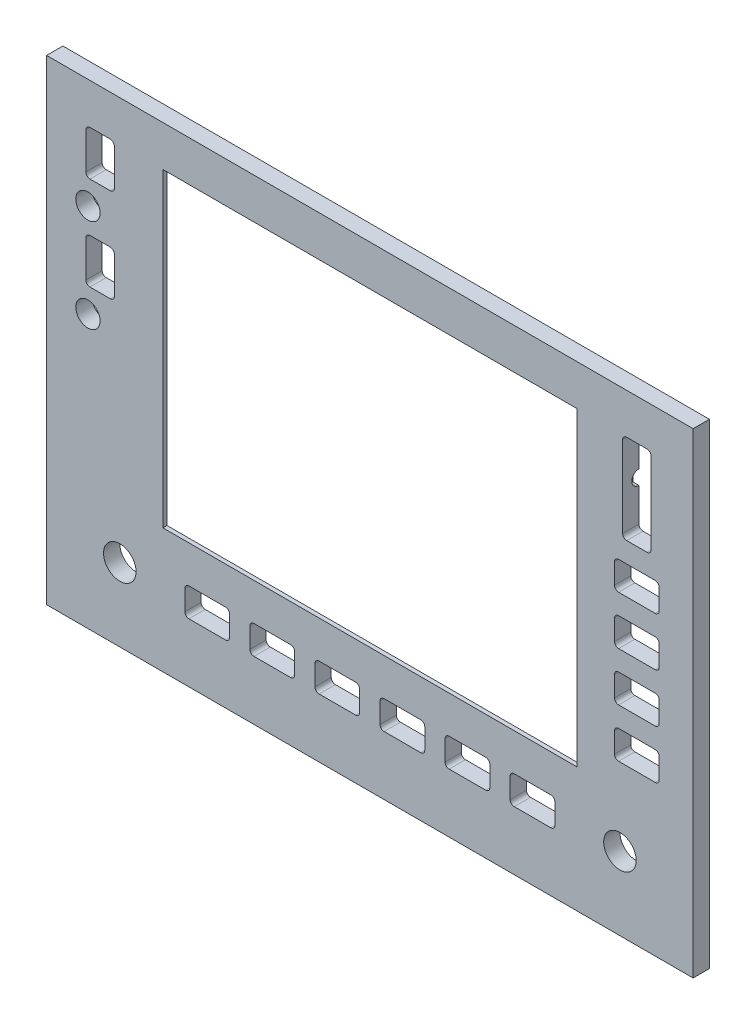
from build123d import *

# Parameters (mm, degrees)
ESQUISSE1_W                  = 159
ESQUISSE1_H                  = 117
BOSS_EXTRU_1_DEPTH           = 4
ESQUISSE3_W                  = 101.76
ESQUISSE3_H                  = 76.32
ENL_V_MAT_EXTRU_2_DEPTH      = 4
ESQUISSE9_W                  = 118
ESQUISSE9_H                  = 88.9
ENL_V_MAT_EXTRU_5_DEPTH      = 3
ESQUISSE4_R                  = 4
ENL_V_MAT_EXTRU_3_DEPTH      = 4
ESQUISSE10_R                 = 3
ENL_V_MAT_EXTRU_6_DEPTH      = 4
ENL_V_MAT_EXTRU_7_DEPTH      = 8.5
ENL_V_MAT_EXTRU_7_DEPTH_BACK = 1.5
ESQUISSE11_R                 = 1.75


with BuildPart() as part:
    # Esquisse1 → Boss.-Extru.1 (new body)
    with BuildSketch(Plane.XY):
        with Locations((79.5, 58.5)):
            Rectangle(ESQUISSE1_W, ESQUISSE1_H)
    extrude(amount=BOSS_EXTRU_1_DEPTH)

    # Esquisse3 → Enlèv. mat.-Extru.2 (cut)
    with BuildSketch(Plane.XY.offset(4)):
        with Locations((79.5, 68.84)):
            Rectangle(ESQUISSE3_W, ESQUISSE3_H)
    extrude(amount=-ENL_V_MAT_EXTRU_2_DEPTH, mode=Mode.SUBTRACT)

    # Esquisse9 → Enlèv. mat.-Extru.5 (cut)
    with BuildSketch(Plane(origin=(0, 0, 0), x_dir=(-1, 0, 0), z_dir=(0, 0, -1))):
        with Locations((-79.163992303, 67.176625881)):
            Rectangle(ESQUISSE9_W, ESQUISSE9_H)
    extrude(amount=-ENL_V_MAT_EXTRU_5_DEPTH, mode=Mode.SUBTRACT)

    # Esquisse4 → Enlèv. mat.-Extru.3 (cut)
    with BuildSketch(Plane.XY.offset(4)):
        with Locations((141, 18)):
            Circle(ESQUISSE4_R)
        with Locations((18, 18)):
            Circle(ESQUISSE4_R)
    extrude(amount=-ENL_V_MAT_EXTRU_3_DEPTH, mode=Mode.SUBTRACT)

    # Esquisse10 → Enlèv. mat.-Extru.6 (cut)
    with BuildSketch(Plane(origin=(0, 0, 0), x_dir=(-1, 0, 0), z_dir=(0, 0, -1))):
        with Locations((-10.163992303, 90)):
            Circle(ESQUISSE10_R)
        with Locations((-10.163992303, 67)):
            Circle(ESQUISSE10_R)
        with BuildLine():
            Line((-124, 21.5), (-115, 21.5))
            ThreePointArc((-115, 21.5), (-114.292893219, 21.207106781), (-114, 20.5))
            Line((-114, 20.5), (-114, 15.5))
            ThreePointArc((-114, 15.5), (-114.292893219, 14.792893219), (-115, 14.5))
            Line((-115, 14.5), (-124, 14.5))
            ThreePointArc((-124, 14.5), (-124.707106781, 14.792893219), (-125, 15.5))
            Line((-125, 15.5), (-125, 20.5))
            ThreePointArc((-125, 20.5), (-124.707106781, 21.207106781), (-124, 21.5))
        make_face()
        with BuildLine():
            Line((-108, 21.5), (-99, 21.5))
            ThreePointArc((-99, 21.5), (-98.292893219, 21.207106781), (-98, 20.5))
            Line((-98, 20.5), (-98, 15.5))
            ThreePointArc((-98, 15.5), (-98.292893219, 14.792893219), (-99, 14.5))
            Line((-99, 14.5), (-108, 14.5))
            ThreePointArc((-108, 14.5), (-108.707106781, 14.792893219), (-109, 15.5))
            Line((-109, 15.5), (-109, 20.5))
            ThreePointArc((-109, 20.5), (-108.707106781, 21.207106781), (-108, 21.5))
        make_face()
        with BuildLine():
            Line((-92, 21.5), (-83, 21.5))
            ThreePointArc((-83, 21.5), (-82.292893219, 21.207106781), (-82, 20.5))
            Line((-82, 20.5), (-82, 15.5))
            ThreePointArc((-82, 15.5), (-82.292893219, 14.792893219), (-83, 14.5))
            Line((-83, 14.5), (-92, 14.5))
            ThreePointArc((-92, 14.5), (-92.707106781, 14.792893219), (-93, 15.5))
            Line((-93, 15.5), (-93, 20.5))
            ThreePointArc((-93, 20.5), (-92.707106781, 21.207106781), (-92, 21.5))
        make_face()
        with BuildLine():
            Line((-76, 21.5), (-67, 21.5))
            ThreePointArc((-67, 21.5), (-66.292893219, 21.207106781), (-66, 20.5))
            Line((-66, 20.5), (-66, 15.5))
            ThreePointArc((-66, 15.5), (-66.292893219, 14.792893219), (-67, 14.5))
            Line((-67, 14.5), (-76, 14.5))
            ThreePointArc((-76, 14.5), (-76.707106781, 14.792893219), (-77, 15.5))
            Line((-77, 15.5), (-77, 20.5))
            ThreePointArc((-77, 20.5), (-76.707106781, 21.207106781), (-76, 21.5))
        make_face()
        with BuildLine():
            Line((-60, 21.5), (-51, 21.5))
            ThreePointArc((-51, 21.5), (-50.292893219, 21.207106781), (-50, 20.5))
            Line((-50, 20.5), (-50, 15.5))
            ThreePointArc((-50, 15.5), (-50.292893219, 14.792893219), (-51, 14.5))
            Line((-51, 14.5), (-60, 14.5))
            ThreePointArc((-60, 14.5), (-60.707106781, 14.792893219), (-61, 15.5))
            Line((-61, 15.5), (-61, 20.5))
            ThreePointArc((-61, 20.5), (-60.707106781, 21.207106781), (-60, 21.5))
        make_face()
        with BuildLine():
            Line((-44, 21.5), (-35, 21.5))
            ThreePointArc((-35, 21.5), (-34.292893219, 21.207106781), (-34, 20.5))
            Line((-34, 20.5), (-34, 15.5))
            ThreePointArc((-34, 15.5), (-34.292893219, 14.792893219), (-35, 14.5))
            Line((-35, 14.5), (-44, 14.5))
            ThreePointArc((-44, 14.5), (-44.707106781, 14.792893219), (-45, 15.5))
            Line((-45, 15.5), (-45, 20.5))
            ThreePointArc((-45, 20.5), (-44.707106781, 21.207106781), (-44, 21.5))
        make_face()
        with BuildLine():
            Line((-147.663992303, 107), (-142.663992303, 107))
            ThreePointArc((-142.663992303, 107), (-141.956885522, 106.707106781), (-141.663992303, 106))
            Line((-141.663992303, 106), (-141.663992303, 86))
            ThreePointArc((-141.663992303, 86), (-141.956885522, 85.292893219), (-142.663992303, 85))
            Line((-142.663992303, 85), (-147.663992303, 85))
            ThreePointArc((-147.663992303, 85), (-148.371099084, 85.292893219), (-148.663992303, 86))
            Line((-148.663992303, 86), (-148.663992303, 106))
            ThreePointArc((-148.663992303, 106), (-148.371099084, 106.707106781), (-147.663992303, 107))
        make_face()
        with BuildLine():
            Line((-149.663992303, 80), (-140.663992303, 80))
            ThreePointArc((-140.663992303, 80), (-139.956885522, 79.707106781), (-139.663992303, 79))
            Line((-139.663992303, 79), (-139.663992303, 74))
            ThreePointArc((-139.663992303, 74), (-139.956885522, 73.292893219), (-140.663992303, 73))
            Line((-140.663992303, 73), (-149.663992303, 73))
            ThreePointArc((-149.663992303, 73), (-150.371099084, 73.292893219), (-150.663992303, 74))
            Line((-150.663992303, 74), (-150.663992303, 79))
            ThreePointArc((-150.663992303, 79), (-150.371099084, 79.707106781), (-149.663992303, 80))
        make_face()
        with BuildLine():
            Line((-149.663992303, 68), (-140.663992303, 68))
            ThreePointArc((-140.663992303, 68), (-139.956885522, 67.707106781), (-139.663992303, 67))
            Line((-139.663992303, 67), (-139.663992303, 62))
            ThreePointArc((-139.663992303, 62), (-139.956885522, 61.292893219), (-140.663992303, 61))
            Line((-140.663992303, 61), (-149.663992303, 61))
            ThreePointArc((-149.663992303, 61), (-150.371099084, 61.292893219), (-150.663992303, 62))
            Line((-150.663992303, 62), (-150.663992303, 67))
            ThreePointArc((-150.663992303, 67), (-150.371099084, 67.707106781), (-149.663992303, 68))
        make_face()
        with BuildLine():
            Line((-149.663992303, 56), (-140.663992303, 56))
            ThreePointArc((-140.663992303, 56), (-139.956885522, 55.707106781), (-139.663992303, 55))
            Line((-139.663992303, 55), (-139.663992303, 50))
            ThreePointArc((-139.663992303, 50), (-139.956885522, 49.292893219), (-140.663992303, 49))
            Line((-140.663992303, 49), (-149.663992303, 49))
            ThreePointArc((-149.663992303, 49), (-150.371099084, 49.292893219), (-150.663992303, 50))
            Line((-150.663992303, 50), (-150.663992303, 55))
            ThreePointArc((-150.663992303, 55), (-150.371099084, 55.707106781), (-149.663992303, 56))
        make_face()
        with BuildLine():
            Line((-149.663992303, 44), (-140.663992303, 44))
            ThreePointArc((-140.663992303, 44), (-139.956885522, 43.707106781), (-139.663992303, 43))
            Line((-139.663992303, 43), (-139.663992303, 38))
            ThreePointArc((-139.663992303, 38), (-139.956885522, 37.292893219), (-140.663992303, 37))
            Line((-140.663992303, 37), (-149.663992303, 37))
            ThreePointArc((-149.663992303, 37), (-150.371099084, 37.292893219), (-150.663992303, 38))
            Line((-150.663992303, 38), (-150.663992303, 43))
            ThreePointArc((-150.663992303, 43), (-150.371099084, 43.707106781), (-149.663992303, 44))
        make_face()
        with BuildLine():
            Line((-15.663992303, 107), (-10.663992303, 107))
            ThreePointArc((-10.663992303, 107), (-9.956885522, 106.707106781), (-9.663992303, 106))
            Line((-9.663992303, 106), (-9.663992303, 97))
            ThreePointArc((-9.663992303, 97), (-9.956885522, 96.292893219), (-10.663992303, 96))
            Line((-10.663992303, 96), (-15.663992303, 96))
            ThreePointArc((-15.663992303, 96), (-16.371099084, 96.292893219), (-16.663992303, 97))
            Line((-16.663992303, 97), (-16.663992303, 106))
            ThreePointArc((-16.663992303, 106), (-16.371099084, 106.707106781), (-15.663992303, 107))
        make_face()
        with BuildLine():
            Line((-15.663992303, 84), (-10.663992303, 84))
            ThreePointArc((-10.663992303, 84), (-9.956885522, 83.707106781), (-9.663992303, 83))
            Line((-9.663992303, 83), (-9.663992303, 74))
            ThreePointArc((-9.663992303, 74), (-9.956885522, 73.292893219), (-10.663992303, 73))
            Line((-10.663992303, 73), (-15.663992303, 73))
            ThreePointArc((-15.663992303, 73), (-16.371099084, 73.292893219), (-16.663992303, 74))
            Line((-16.663992303, 74), (-16.663992303, 83))
            ThreePointArc((-16.663992303, 83), (-16.371099084, 83.707106781), (-15.663992303, 84))
        make_face()
    extrude(amount=-ENL_V_MAT_EXTRU_6_DEPTH, mode=Mode.SUBTRACT)

    # Esquisse11 → Enlèv. mat.-Extru.7 (cut, two sides: drawn at the far end of the back side and taken through both)
    with BuildSketch(Plane.ZY.offset(-148.663992303).offset(-ENL_V_MAT_EXTRU_7_DEPTH_BACK)):
        with Locations((0, 96)):
            Circle(ESQUISSE11_R)
    extrude(amount=ENL_V_MAT_EXTRU_7_DEPTH + ENL_V_MAT_EXTRU_7_DEPTH_BACK, mode=Mode.SUBTRACT)


solid = part.part
